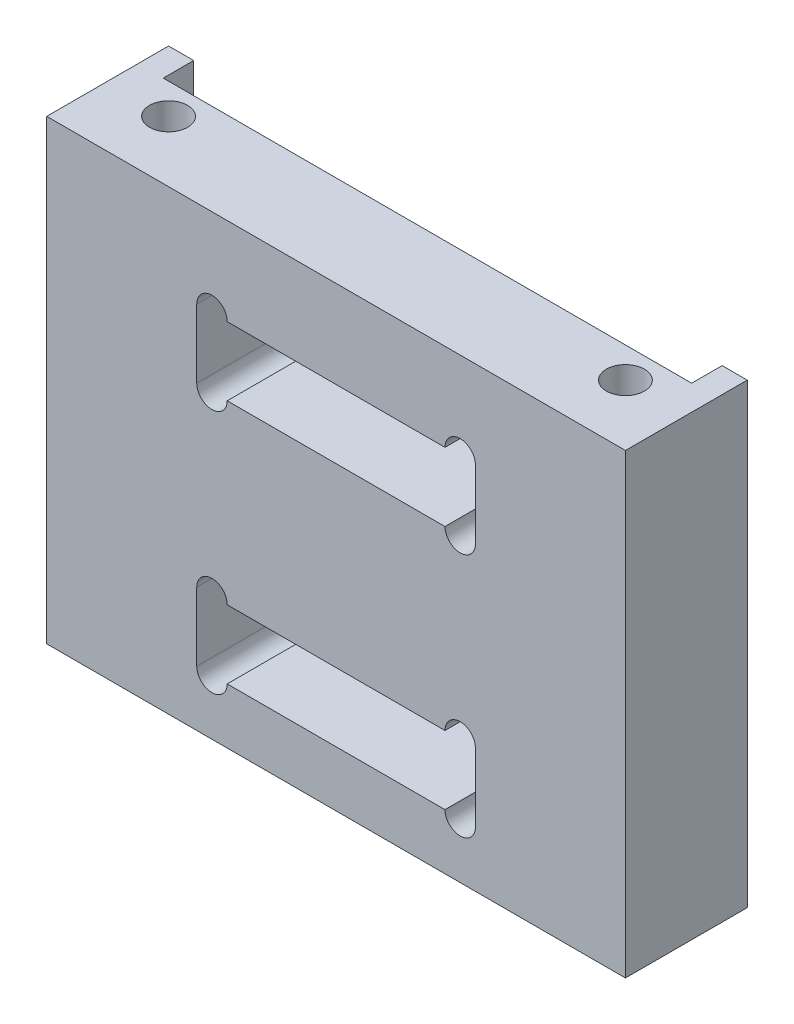
from build123d import *

# Parameters (mm, degrees)
SKETCH1_W                   = 38
SKETCH1_H                   = 30
BOSS_EXTRUDE1_DEPTH         = 4
CUT_EXTRUDE1_DEPTH          = 2
CUT_EXTRUDE2_DEPTH          = 25.939927827
TAP_DRILL_FOR_M3_TAP1_D     = 2.5
TAP_DRILL_FOR_M3_TAP1_DEPTH = 5
TAP_DRILL_FOR_M3_TAP1_TIP   = 0.751075774


with BuildPart() as part:
    # Sketch1 → Boss-Extrude1 (new, symmetric)
    with BuildSketch(Plane.XY):
        Rectangle(SKETCH1_W, SKETCH1_H)
    extrude(amount=BOSS_EXTRUDE1_DEPTH, both=True)

    # Sketch2 → Cut-Extrude1 (cut)
    with BuildSketch(Plane.XY.offset(-4)):
        with BuildLine():
            Line((-17.35, -13.2), (-17.35, -3.15))
            Line((-17.35, -3.15), (-17.35, -1.5))
            Line((-17.35, -1.5), (-17.35, 15.5))
            ThreePointArc((-17.35, 15.5), (-16.910660172, 16.560660172), (-15.85, 17))
            Line((-15.85, 17), (15.85, 17))
            ThreePointArc((15.85, 17), (16.910660172, 16.560660172), (17.35, 15.5))
            Line((17.35, 15.5), (17.35, -1.5))
            Line((17.35, -1.5), (17.35, -3.15))
            Line((17.35, -3.15), (17.35, -13.2))
            Line((17.35, -13.2), (17.35, -15))
            Line((17.35, -15), (-17.35, -15))
            Line((-17.35, -15), (-17.35, -13.2))
        make_face()
    extrude(amount=CUT_EXTRUDE1_DEPTH, mode=Mode.SUBTRACT)

    # Sketch3 → Cut-Extrude2 (cut, through all)
    with BuildSketch(Plane(origin=(0, 0, -2), x_dir=(-1, 0, 0), z_dir=(0, 0, -1))):
        with BuildLine():
            Line((9.15, 9.25), (9.15, 4.75))
            ThreePointArc((9.15, 4.75), (8.15, 3.75), (7.15, 4.75))
            Line((7.15, 4.75), (-7.15, 4.75))
            ThreePointArc((-7.15, 4.75), (-8.15, 3.75), (-9.15, 4.75))
            Line((-9.15, 4.75), (-9.15, 9.25))
            ThreePointArc((-9.15, 9.25), (-8.15, 10.25), (-7.15, 9.25))
            Line((-7.15, 9.25), (7.15, 9.25))
            ThreePointArc((7.15, 9.25), (8.15, 10.25), (9.15, 9.25))
        make_face()
        with BuildLine():
            Line((-7.15, -6.85), (7.15, -6.85))
            ThreePointArc((7.15, -6.85), (8.15, -5.85), (9.15, -6.85))
            Line((9.15, -6.85), (9.15, -11.35))
            ThreePointArc((9.15, -11.35), (8.15, -12.35), (7.15, -11.35))
            Line((7.15, -11.35), (-7.15, -11.35))
            ThreePointArc((-7.15, -11.35), (-8.15, -12.35), (-9.15, -11.35))
            Line((-9.15, -11.35), (-9.15, -6.85))
            ThreePointArc((-9.15, -6.85), (-8.15, -5.85), (-7.15, -6.85))
        make_face()
    extrude(amount=-CUT_EXTRUDE2_DEPTH, mode=Mode.SUBTRACT)

    # Sketch5 → M3 Tapped Hole1 (revolve, cut)
    with BuildSketch(Plane(origin=(14.5, -15, 0), x_dir=(0, 0, -1), z_dir=(1, 0, 0))):
        Polygon((0, 0), (0, 6.751075774), (1.25, 6), (1.25, 0), align=None)
    m3_tapped_hole1 = revolve(axis=Axis((14.5, -21.35, 0), (0, 1, 0)), mode=Mode.SUBTRACT)

    # Mirror1: M3 Tapped Hole1 across plane
    add(m3_tapped_hole1.mirror(Plane(origin=(0, 0, 0), x_dir=(0, 0, 1), z_dir=(1, 0, 0))), mode=Mode.SUBTRACT)

    # Tap Drill for M3 Tap1
    with Locations(Plane(origin=(0, 15, 0), x_dir=(1, 0, 0), z_dir=(0, 1, 0))):
        with Locations((15, 0), (-15, 0)):
            Hole(TAP_DRILL_FOR_M3_TAP1_D / 2, depth=TAP_DRILL_FOR_M3_TAP1_DEPTH)
            with Locations((0, 0, -(TAP_DRILL_FOR_M3_TAP1_DEPTH + TAP_DRILL_FOR_M3_TAP1_TIP / 2))):  # 118° drill point
                Cone(0, TAP_DRILL_FOR_M3_TAP1_D / 2, TAP_DRILL_FOR_M3_TAP1_TIP, mode=Mode.SUBTRACT)


solid = part.part
